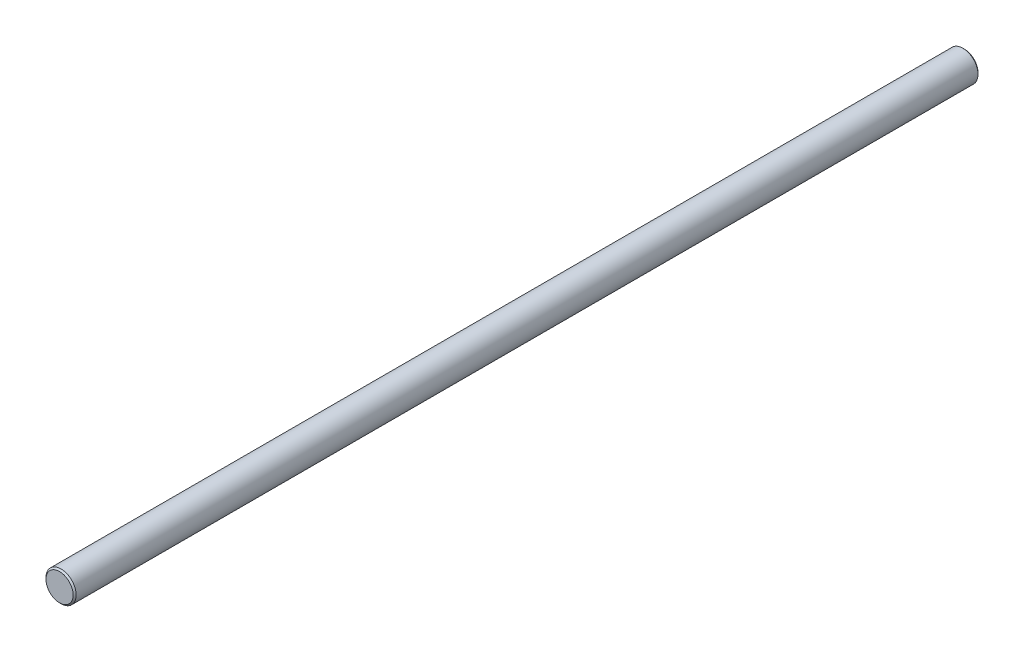
from build123d import *

# Parameters (mm, degrees)
SKETCH_1_R      = 5
EXTRUDE_1_DEPTH = 300
CHAMFER_1_SIZE  = 0.5


with BuildPart() as part:
    # 草图1 → 凸台-拉伸1 (new body)
    with BuildSketch(Plane.XY):
        Circle(SKETCH_1_R)
    extrude(amount=EXTRUDE_1_DEPTH)

    # 倒角1
    chamfer_1_edges = [part.edges().sort_by_distance(p)[0] for p in [
        (-5, 0, 0),
        (-5, 0, 300),
    ]]
    chamfer(chamfer_1_edges, length=CHAMFER_1_SIZE)


solid = part.part
